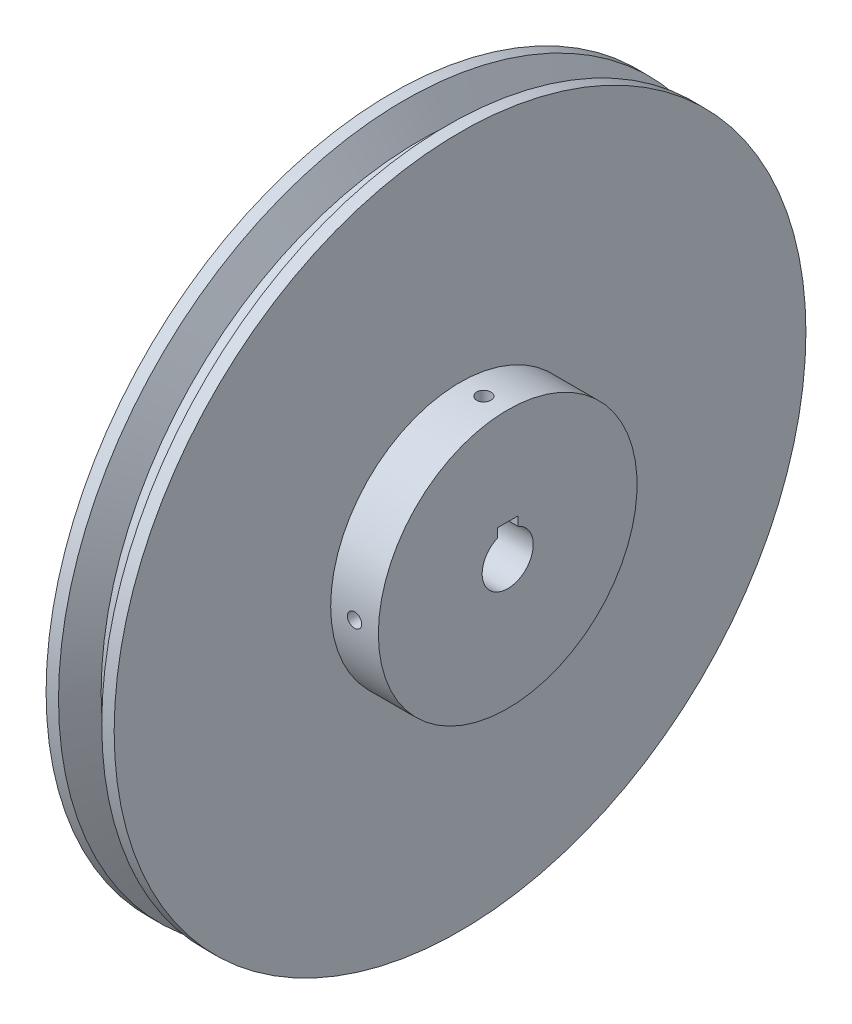
from build123d import *

# Parameters (mm, degrees)
CORTAR_EXTRUIR1_DEPTH                          = 34
PERFORADOR_PARA_ROSCAR_PARA_MACHO_DE_ROS_D     = 4.2
PERFORADOR_PARA_ROSCAR_PARA_MACHO_DE_ROS_DEPTH = 40
PERFORADOR_PARA_ROSCAR_PARA_MACHO_DE_ROS_TIP   = 1.2618073
PERFORADOR_PARA_ROSCAR_PARA_MACHO_DE_2_D       = 4.2
PERFORADOR_PARA_ROSCAR_PARA_MACHO_DE_2_DEPTH   = 40
PERFORADOR_PARA_ROSCAR_PARA_MACHO_DE_2_TIP     = 1.2618073


with BuildPart() as part:
    # Croquis1 → Revolución1 (revolve)
    with BuildSketch(Plane.XY, mode=Mode.PRIVATE) as revoluci_n1_sk:
        Polygon((0, 0), (34, 0), (34, 38), (20, 38), (20, 101.6), (16.35, 101.6), (11.767282238, 93.6625), (8.232717762, 93.6625), (3.65, 101.6), (0, 101.6), align=None)
    revolve(revoluci_n1_sk.sketch.rotate(Axis((0, 0, 0), (1, 0, 0)), 90), axis=Axis((0, 0, 0), (1, 0, 0)))

    # Croquis2 → Cortar-Extruir1 (cut)
    with BuildSketch(Plane(origin=(34, 0, 0), x_dir=(0, 0, -1), z_dir=(1, 0, 0))):
        with BuildLine():
            Line((-3, 9.5), (3, 9.5))
            Line((3, 9.5), (3, 6.873863542))
            ThreePointArc((3, 6.873863542), (0, -7.5), (-3, 6.873863542))
            Line((-3, 6.873863542), (-3, 9.5))
        make_face()
    extrude(amount=-CORTAR_EXTRUIR1_DEPTH, mode=Mode.SUBTRACT)

    # Perforador para roscar para macho de roscar para M51
    with Locations(Plane(origin=(27, 0, 38), x_dir=(1, 0, 0), z_dir=(0, 0, 1))):
        with Locations((0, 0)):
            Hole(PERFORADOR_PARA_ROSCAR_PARA_MACHO_DE_ROS_D / 2, depth=PERFORADOR_PARA_ROSCAR_PARA_MACHO_DE_ROS_DEPTH)
            with Locations((0, 0, -(PERFORADOR_PARA_ROSCAR_PARA_MACHO_DE_ROS_DEPTH + PERFORADOR_PARA_ROSCAR_PARA_MACHO_DE_ROS_TIP / 2))):  # 118° drill point
                Cone(0, PERFORADOR_PARA_ROSCAR_PARA_MACHO_DE_ROS_D / 2, PERFORADOR_PARA_ROSCAR_PARA_MACHO_DE_ROS_TIP, mode=Mode.SUBTRACT)

    # Perforador para roscar para macho de 2
    with Locations(Plane(origin=(27, 38, 0), x_dir=(0, 0, 1), z_dir=(0, 1, 0))):
        with Locations((0, 0)):
            Hole(PERFORADOR_PARA_ROSCAR_PARA_MACHO_DE_2_D / 2, depth=PERFORADOR_PARA_ROSCAR_PARA_MACHO_DE_2_DEPTH)
            with Locations((0, 0, -(PERFORADOR_PARA_ROSCAR_PARA_MACHO_DE_2_DEPTH + PERFORADOR_PARA_ROSCAR_PARA_MACHO_DE_2_TIP / 2))):  # 118° drill point
                Cone(0, PERFORADOR_PARA_ROSCAR_PARA_MACHO_DE_2_D / 2, PERFORADOR_PARA_ROSCAR_PARA_MACHO_DE_2_TIP, mode=Mode.SUBTRACT)


solid = part.part
